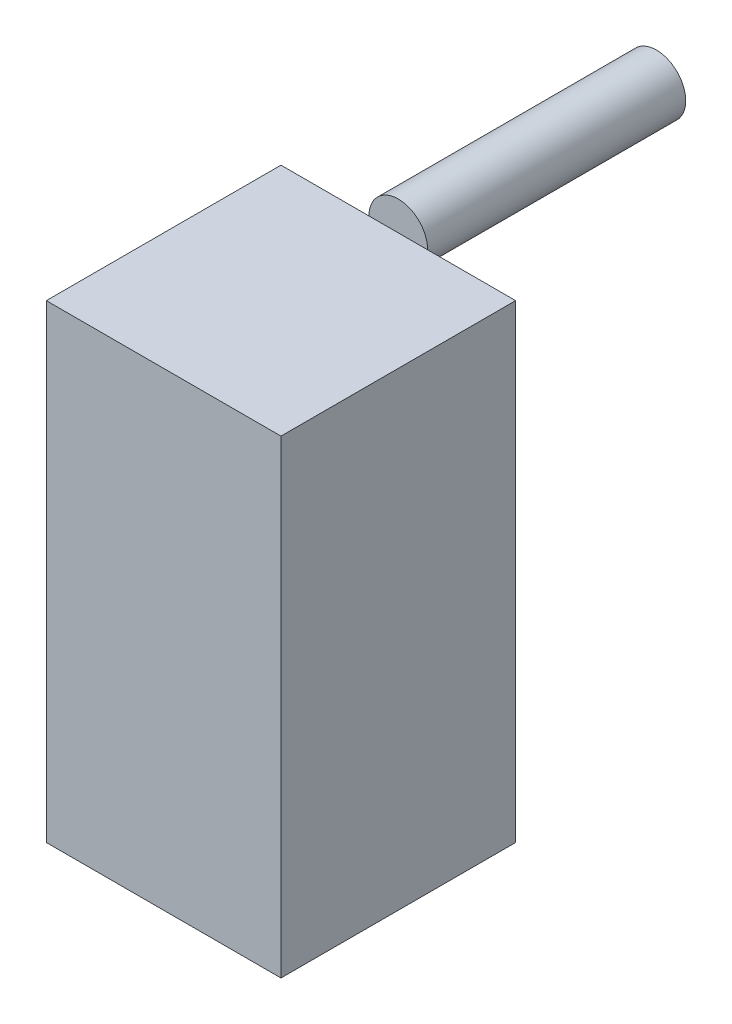
from build123d import *

# Parameters (mm, degrees)
SKETCH1_W           = 20
SKETCH1_H           = 20
BOSS_EXTRUDE1_DEPTH = 40
SKETCH3_R           = 2.5
BOSS_EXTRUDE3_DEPTH = 22


with BuildPart() as part:
    # Sketch1 → Boss-Extrude1 (new body)
    with BuildSketch(Plane(origin=(0, 0, 0), x_dir=(1, 0, 0), z_dir=(0, 1, 0))):
        Rectangle(SKETCH1_W, SKETCH1_H)
    extrude(amount=BOSS_EXTRUDE1_DEPTH)

    # Sketch3 → Boss-Extrude3 (add)
    with BuildSketch(Plane(origin=(0, 0, -10), x_dir=(-1, 0, 0), z_dir=(0, 0, -1))):
        with Locations((0, 40)):
            Circle(SKETCH3_R)
    extrude(amount=BOSS_EXTRUDE3_DEPTH)


solid = part.part
